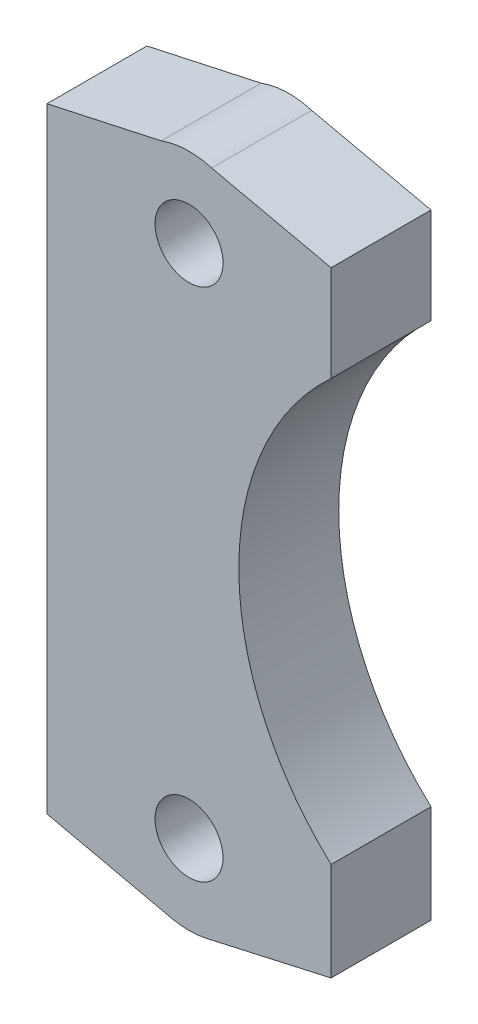
from build123d import *

# Parameters (mm, degrees)
SKETCH2_R           = 1.7
BOSS_EXTRUDE1_DEPTH = 5


with BuildPart() as part:
    # Sketch2 → Boss-Extrude1 (new body)
    with BuildSketch(Plane.XY.offset(0.022274507)):
        with BuildLine():
            Line((26.815853016, -16.790117538), (20.584977895, -15.389970557))
            Line((20.584977895, -15.389970557), (20.584977895, 15.389970557))
            Line((20.584977895, 15.389970557), (26.298427654, 16.636497968))
            ThreePointArc((26.298427654, 16.636497968), (27.556656853, 16.885073389), (28.828845221, 16.722385915))
            Line((28.828845221, 16.722385915), (34.799540996, 15.389970557))
            Line((34.799540996, 15.389970557), (34.799540996, 10.589698359))
            ThreePointArc((34.799540996, 10.589698359), (30.183127704, 0.060029443), (34.799540996, -10.469639472))
            Line((34.799540996, -10.469639472), (34.799540996, -15.389970557))
            Line((34.799540996, -15.389970557), (28.568665876, -16.790117538))
            ThreePointArc((28.568665876, -16.790117538), (27.692259446, -16.887374052), (26.815853016, -16.790117538))
        make_face()
        with Locations((27.692259446, -12.889970557)):
            Circle(SKETCH2_R, mode=Mode.SUBTRACT)
        with Locations((27.692259446, 12.889970557)):
            Circle(SKETCH2_R, mode=Mode.SUBTRACT)
    extrude(amount=BOSS_EXTRUDE1_DEPTH)


solid = part.part
